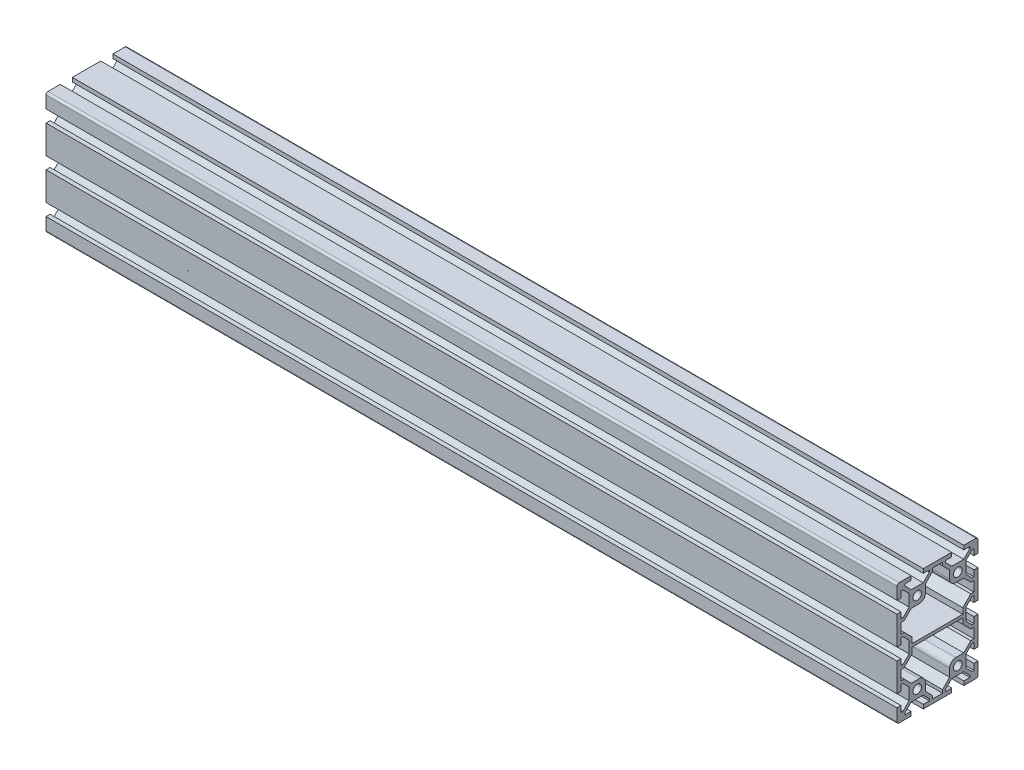
from build123d import *

# Parameters (mm, degrees)
SKETCH1_R           = 2.1
BOSS_EXTRUDE1_DEPTH = 420


with BuildPart() as part:
    # Sketch1 → Boss-Extrude1 (new body)
    with BuildSketch(Plane(origin=(0, 0, 0), x_dir=(0, 0, -1), z_dir=(1, 0, 0))):
        with BuildLine():
            Line((-20, 29), (-20, 23))
            Line((-20, 23), (-18, 23))
            Line((-18, 23), (-18, 26))
            Line((-18, 26), (-17.060660172, 26))
            Line((-17.060660172, 26), (-14, 22.939339828))
            Line((-14, 22.939339828), (-14, 17.060660172))
            Line((-14, 17.060660172), (-17.060660172, 14))
            Line((-17.060660172, 14), (-18, 14))
            Line((-18, 14), (-18, 17))
            Line((-18, 17), (-20, 17))
            Line((-20, 17), (-20, 3))
            Line((-20, 3), (-18, 3))
            Line((-18, 3), (-18, 6))
            Line((-18, 6), (-17.060660172, 6))
            Line((-17.060660172, 6), (-14, 2.939339828))
            Line((-14, 2.939339828), (-14, -2.939339828))
            Line((-14, -2.939339828), (-17.060660172, -6))
            Line((-17.060660172, -6), (-18, -6))
            Line((-18, -6), (-18, -3))
            Line((-18, -3), (-20, -3))
            Line((-20, -3), (-20, -17))
            Line((-20, -17), (-18, -17))
            Line((-18, -17), (-18, -14))
            Line((-18, -14), (-17.060660172, -14))
            Line((-17.060660172, -14), (-14, -17.060660172))
            Line((-14, -17.060660172), (-14, -22.939339828))
            Line((-14, -22.939339828), (-17.060660172, -26))
            Line((-17.060660172, -26), (-18, -26))
            Line((-18, -26), (-18, -23))
            Line((-18, -23), (-20, -23))
            Line((-20, -23), (-20, -29))
            ThreePointArc((-20, -29), (-19.707106781, -29.707106781), (-19, -30))
            Line((-19, -30), (-13, -30))
            Line((-13, -30), (-13, -28))
            Line((-13, -28), (-16, -28))
            Line((-16, -28), (-16, -27.060660172))
            Line((-16, -27.060660172), (-12.939339828, -24))
            Line((-12.939339828, -24), (-7.060660172, -24))
            Line((-7.060660172, -24), (-4, -27.060660172))
            Line((-4, -27.060660172), (-4, -28))
            Line((-4, -28), (-7, -28))
            Line((-7, -28), (-7, -30))
            Line((-7, -30), (7, -30))
            Line((7, -30), (7, -28))
            Line((7, -28), (4, -28))
            Line((4, -28), (4, -27.060660172))
            Line((4, -27.060660172), (7.060660172, -24))
            Line((7.060660172, -24), (12.939339828, -24))
            Line((12.939339828, -24), (16, -27.060660172))
            Line((16, -27.060660172), (16, -28))
            Line((16, -28), (13, -28))
            Line((13, -28), (13, -30))
            Line((13, -30), (19, -30))
            ThreePointArc((19, -30), (19.707106781, -29.707106781), (20, -29))
            Line((20, -29), (20, -23))
            Line((20, -23), (18, -23))
            Line((18, -23), (18, -26))
            Line((18, -26), (17.060660172, -26))
            Line((17.060660172, -26), (14, -22.939339828))
            Line((14, -22.939339828), (14, -17.060660172))
            Line((14, -17.060660172), (17.060660172, -14))
            Line((17.060660172, -14), (18, -14))
            Line((18, -14), (18, -17))
            Line((18, -17), (20, -17))
            Line((20, -17), (20, -3))
            Line((20, -3), (18, -3))
            Line((18, -3), (18, -6))
            Line((18, -6), (17.060660172, -6))
            Line((17.060660172, -6), (14, -2.939339828))
            Line((14, -2.939339828), (14, 2.939339828))
            Line((14, 2.939339828), (17.060660172, 6))
            Line((17.060660172, 6), (18, 6))
            Line((18, 6), (18, 3))
            Line((18, 3), (20, 3))
            Line((20, 3), (20, 17))
            Line((20, 17), (18, 17))
            Line((18, 17), (18, 14))
            Line((18, 14), (17.060660172, 14))
            Line((17.060660172, 14), (14, 17.060660172))
            Line((14, 17.060660172), (14, 22.939339828))
            Line((14, 22.939339828), (17.060660172, 26))
            Line((17.060660172, 26), (18, 26))
            Line((18, 26), (18, 23))
            Line((18, 23), (20, 23))
            Line((20, 23), (20, 29))
            ThreePointArc((20, 29), (19.707106781, 29.707106781), (19, 30))
            Line((19, 30), (13, 30))
            Line((13, 30), (13, 28))
            Line((13, 28), (16, 28))
            Line((16, 28), (16, 27.060660172))
            Line((16, 27.060660172), (12.939339828, 24))
            Line((12.939339828, 24), (7.060660172, 24))
            Line((7.060660172, 24), (4, 27.060660172))
            Line((4, 27.060660172), (4, 28))
            Line((4, 28), (7, 28))
            Line((7, 28), (7, 30))
            Line((7, 30), (-7, 30))
            Line((-7, 30), (-7, 28))
            Line((-7, 28), (-4, 28))
            Line((-4, 28), (-4, 27.060660172))
            Line((-4, 27.060660172), (-7.060660172, 24))
            Line((-7.060660172, 24), (-12.939339828, 24))
            Line((-12.939339828, 24), (-16, 27.060660172))
            Line((-16, 27.060660172), (-16, 28))
            Line((-16, 28), (-13, 28))
            Line((-13, 28), (-13, 30))
            Line((-13, 30), (-19, 30))
            ThreePointArc((-19, 30), (-19.707106781, 29.707106781), (-20, 29))
        make_face()
        with Locations((-10, 20)):
            Circle(SKETCH1_R, mode=Mode.SUBTRACT)
        with Locations((10, 20)):
            Circle(SKETCH1_R, mode=Mode.SUBTRACT)
        with Locations((10, -20)):
            Circle(SKETCH1_R, mode=Mode.SUBTRACT)
        with Locations((-10, -20)):
            Circle(SKETCH1_R, mode=Mode.SUBTRACT)
        with BuildLine():
            Line((-16.439339828, 12.5), (-18, 12.5))
            Line((-18, 12.5), (-18, 7.5))
            Line((-18, 7.5), (-16.439339828, 7.5))
            Line((-16.439339828, 7.5), (-12.5, 3.560660172))
            Line((-12.5, 3.560660172), (-12.5, 0.75))
            Line((-12.5, 0.75), (12.5, 0.75))
            Line((12.5, 0.75), (12.5, 3.560660172))
            Line((12.5, 3.560660172), (16.439339828, 7.5))
            Line((16.439339828, 7.5), (18, 7.5))
            Line((18, 7.5), (18, 12.5))
            Line((18, 12.5), (16.439339828, 12.5))
            Line((16.439339828, 12.5), (12.939339828, 16))
            Line((12.939339828, 16), (9, 16))
            ThreePointArc((9, 16), (6.878679656, 16.878679656), (6, 19))
            Line((6, 19), (6, 22.939339828))
            Line((6, 22.939339828), (2.5, 26.439339828))
            Line((2.5, 26.439339828), (2.5, 28))
            Line((2.5, 28), (-2.5, 28))
            Line((-2.5, 28), (-2.5, 26.439339828))
            Line((-2.5, 26.439339828), (-6, 22.939339828))
            Line((-6, 22.939339828), (-6, 19))
            ThreePointArc((-6, 19), (-6.878679656, 16.878679656), (-9, 16))
            Line((-9, 16), (-12.939339828, 16))
            Line((-12.939339828, 16), (-16.439339828, 12.5))
        make_face(mode=Mode.SUBTRACT)
        with BuildLine():
            Line((-18, -7.5), (-18, -12.5))
            Line((-18, -12.5), (-16.439339828, -12.5))
            Line((-16.439339828, -12.5), (-12.939339828, -16))
            Line((-12.939339828, -16), (-9, -16))
            ThreePointArc((-9, -16), (-6.878679656, -16.878679656), (-6, -19))
            Line((-6, -19), (-6, -22.939339828))
            Line((-6, -22.939339828), (-2.5, -26.439339828))
            Line((-2.5, -26.439339828), (-2.5, -28))
            Line((-2.5, -28), (2.5, -28))
            Line((2.5, -28), (2.5, -26.439339828))
            Line((2.5, -26.439339828), (6, -22.939339828))
            Line((6, -22.939339828), (6, -19))
            ThreePointArc((6, -19), (6.878679656, -16.878679656), (9, -16))
            Line((9, -16), (12.939339828, -16))
            Line((12.939339828, -16), (16.439339828, -12.5))
            Line((16.439339828, -12.5), (18, -12.5))
            Line((18, -12.5), (18, -7.5))
            Line((18, -7.5), (16.439339828, -7.5))
            Line((16.439339828, -7.5), (12.5, -3.560660172))
            Line((12.5, -3.560660172), (12.5, -0.75))
            Line((12.5, -0.75), (-12.5, -0.75))
            Line((-12.5, -0.75), (-12.5, -3.560660172))
            Line((-12.5, -3.560660172), (-16.439339828, -7.5))
            Line((-16.439339828, -7.5), (-18, -7.5))
        make_face(mode=Mode.SUBTRACT)
    extrude(amount=BOSS_EXTRUDE1_DEPTH)


solid = part.part
